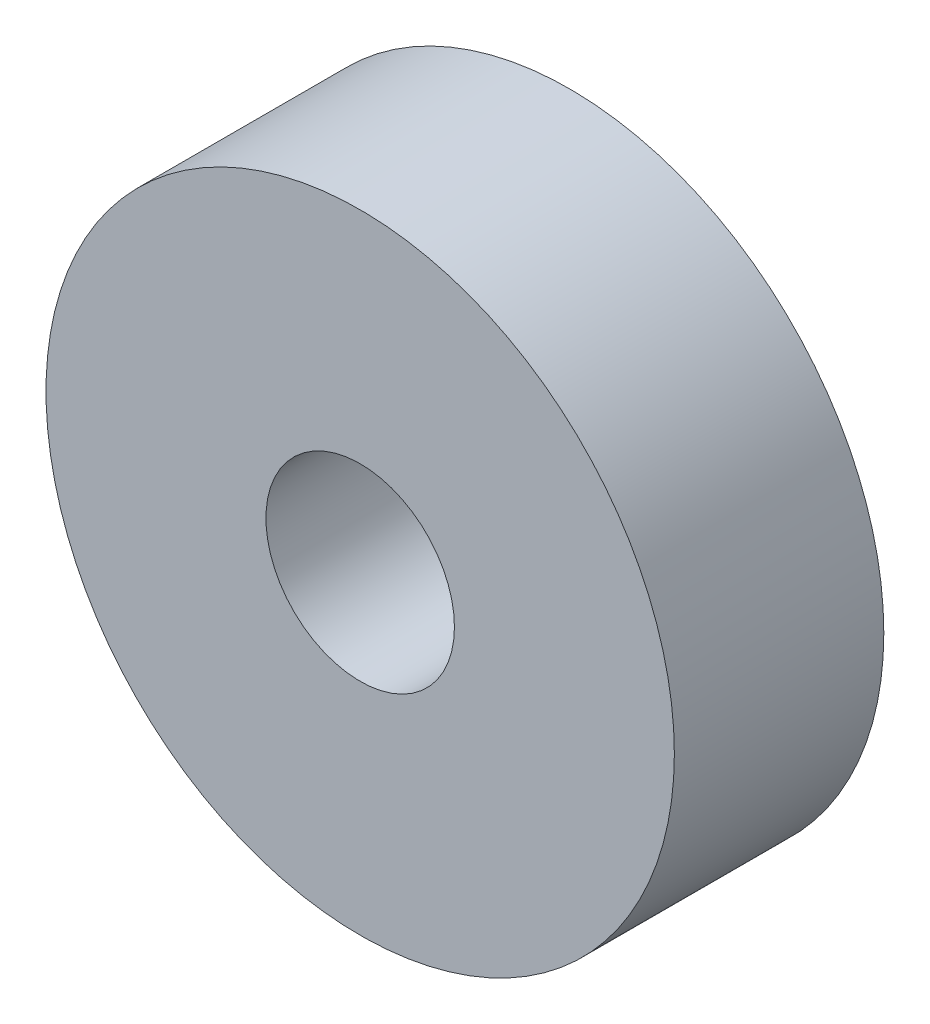
from build123d import *

# Parameters (mm, degrees)
SKETCH_1_R      = 15
SKETCH_1_R_2    = 4.5
EXTRUDE_1_DEPTH = 10


with BuildPart() as part:
    # 草图1 → 凸台-拉伸1 (new body)
    with BuildSketch(Plane.XY):
        Circle(SKETCH_1_R)
        Circle(SKETCH_1_R_2, mode=Mode.SUBTRACT)
    extrude(amount=EXTRUDE_1_DEPTH)


solid = part.part
